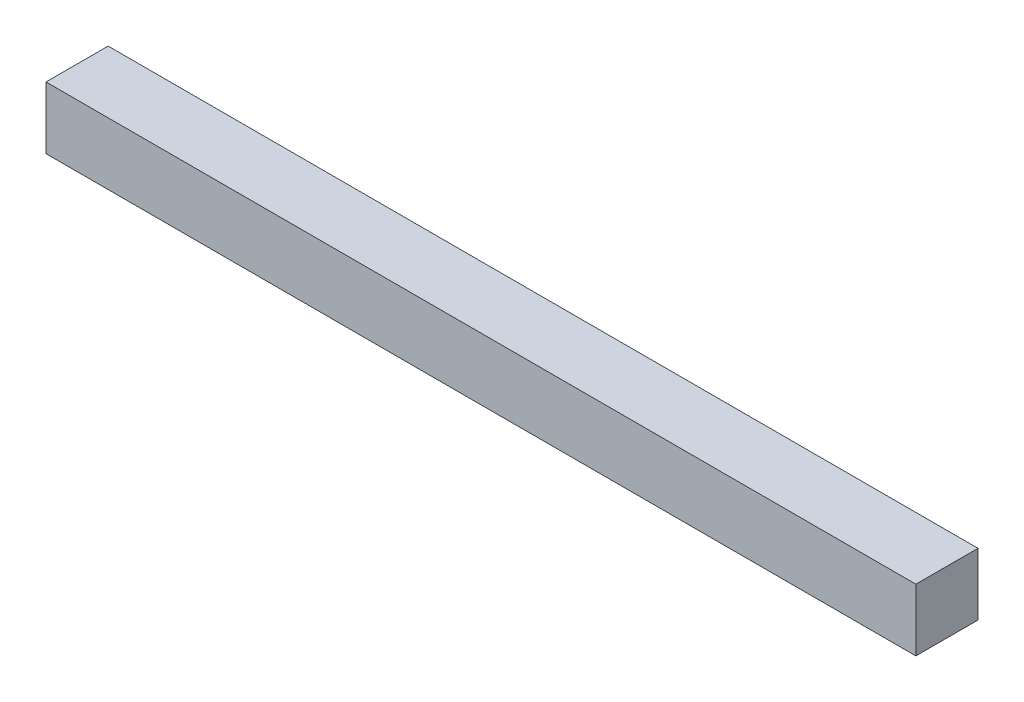
from build123d import *

# Parameters (mm, degrees)
SKETCH5_W           = 533.4
SKETCH5_H           = 38.1
BOSS_EXTRUDE3_DEPTH = 38.1


with BuildPart() as part:
    # Sketch5 → Boss-Extrude3 (new body)
    with BuildSketch(Plane(origin=(0, 0, 0), x_dir=(1, 0, 0), z_dir=(0, 1, 0))):
        Rectangle(SKETCH5_W, SKETCH5_H)
    extrude(amount=BOSS_EXTRUDE3_DEPTH)


solid = part.part
